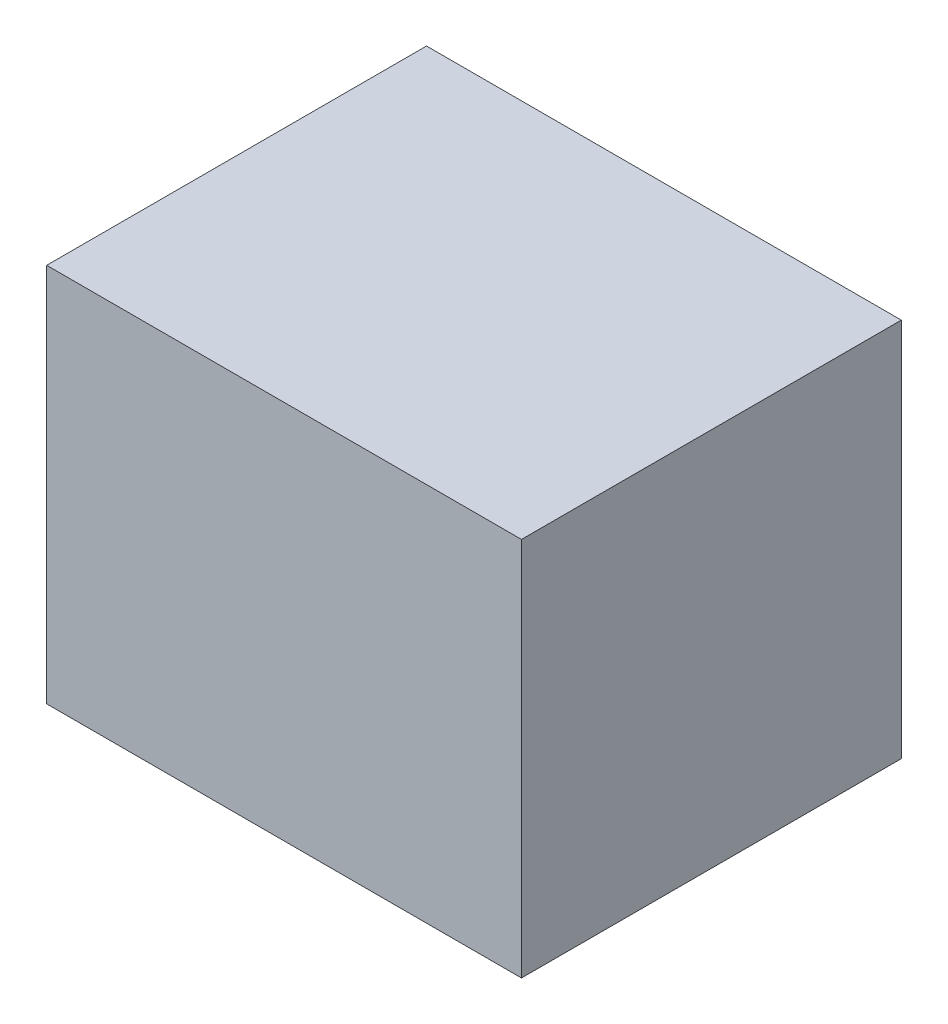
from build123d import *

# Parameters (mm, degrees)
SKETCH1_W           = 25
SKETCH1_H           = 20
BOSS_EXTRUDE1_DEPTH = 10


with BuildPart() as part:
    # Sketch1 → Boss-Extrude1 (new, symmetric)
    with BuildSketch(Plane(origin=(0, 0, 0), x_dir=(1, 0, 0), z_dir=(0, 1, 0))):
        Rectangle(SKETCH1_W, SKETCH1_H)
    extrude(amount=BOSS_EXTRUDE1_DEPTH, both=True)


solid = part.part
